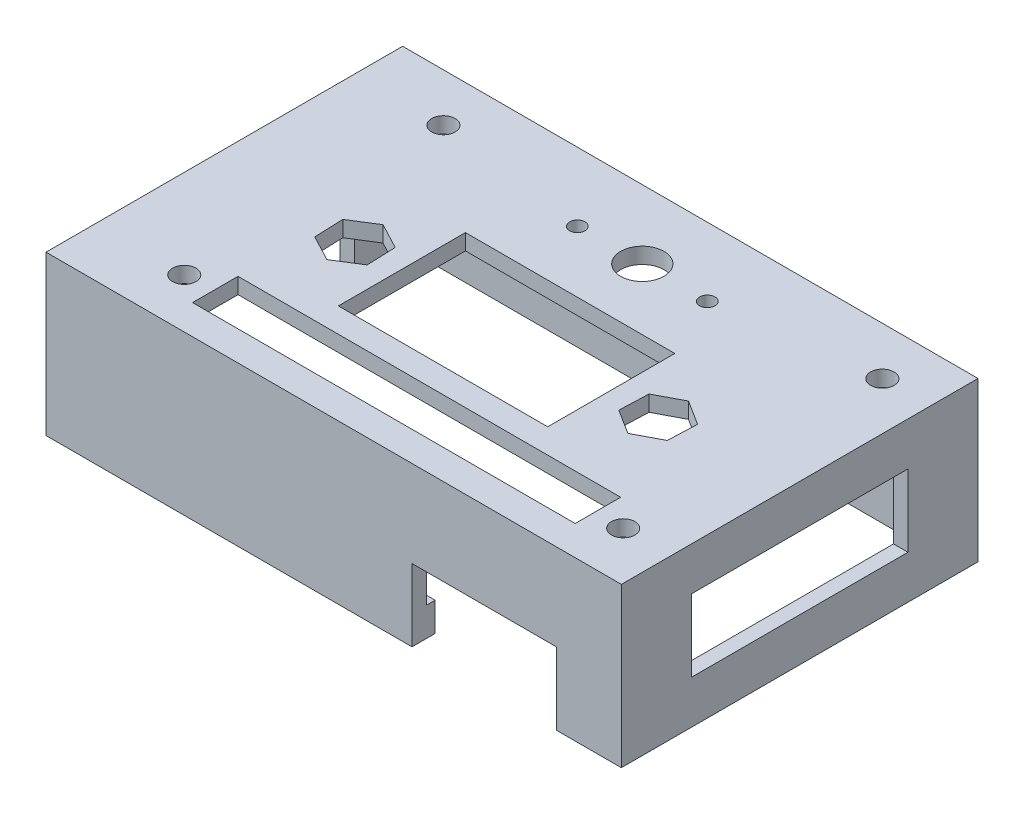
from build123d import *

# Parameters (mm, degrees)
SKETCH_1_W           = 70
SKETCH_1_H           = 45.4
EXTRUDE_1_DEPTH      = 2.2
SKETCH_2_R           = 1.62
CUT_EXTRUDE_1_DEPTH  = 12.2
SKETCH_3_W           = 29
SKETCH_3_H           = 17.6
CUT_EXTRUDE_2_DEPTH  = 12.2
SKETCH_5_R           = 1.07
SKETCH_5_R_2         = 3
CUT_EXTRUDE_4_DEPTH  = 12.2
SKETCH_6_W           = 53
SKETCH_6_H           = 6.3
CUT_EXTRUDE_5_DEPTH  = 12.2
SKETCH_7_W           = 75.7
SKETCH_7_H           = 2
EXTRUDE_3_DEPTH      = 22
SKETCH_8_W           = 2
SKETCH_8_H           = 49.4
EXTRUDE_4_DEPTH      = 22
SKETCH_9_W           = 75.7
SKETCH_9_H           = 2
EXTRUDE_5_DEPTH      = 22
SKETCH_10_W          = 5.7
SKETCH_10_H          = 45.4
EXTRUDE_6_DEPTH      = 2.2
SKETCH_11_W          = 2
SKETCH_11_H          = 49.4
EXTRUDE_7_DEPTH      = 22
SKETCH_12_W          = 20
SKETCH_12_H          = 10
CUT_EXTRUDE_6_DEPTH  = 22
SKETCH_13_W          = 32
SKETCH_13_H          = 6
CUT_EXTRUDE_7_DEPTH  = 22
SKETCH_14_W          = 30
SKETCH_14_H          = 10
CUT_EXTRUDE_8_DEPTH  = 22
SKETCH_16_W          = 70
SKETCH_16_H          = 10
CUT_EXTRUDE_9_DEPTH  = 22
SKETCH_17_W          = 48.7
SKETCH_17_H          = 4
EXTRUDE_8_DEPTH      = 1.2
SKETCH_18_W          = 7
SKETCH_18_H          = 4
EXTRUDE_9_DEPTH      = 1.2
CUT_EXTRUDE_10_DEPTH = 11.2


with BuildPart() as part:
    # 草图1 → 凸台-拉伸1 (new body)
    with BuildSketch(Plane(origin=(0, 0, 0), x_dir=(1, 0, 0), z_dir=(0, 1, 0))):
        Rectangle(SKETCH_1_W, SKETCH_1_H)
    extrude(amount=EXTRUDE_1_DEPTH)

    # 草图2 → 切除-拉伸1 (cut)
    with BuildSketch(Plane(origin=(0, 2.2, 0), x_dir=(1, 0, 0), z_dir=(0, 1, 0))):
        with Locations(Location((-30.4, 18.05, 0), (0, 0, 270))):
            Circle(SKETCH_2_R)
        with Locations(Location((-30.4, -17.85, 0), (0, 0, 270))):
            Circle(SKETCH_2_R)
        with Locations(Location((30.4, -17.85, 0), (0, 0, 270))):
            Circle(SKETCH_2_R)
        with Locations(Location((30.4, 18.05, 0), (0, 0, 270))):
            Circle(SKETCH_2_R)
    extrude(amount=-CUT_EXTRUDE_1_DEPTH, mode=Mode.SUBTRACT)

    # 草图3 → 切除-拉伸2 (cut)
    with BuildSketch(Plane(origin=(0, 2.2, 0), x_dir=(1, 0, 0), z_dir=(0, 1, 0))):
        with Locations((-1.5, -2.1)):
            Rectangle(SKETCH_3_W, SKETCH_3_H)
    extrude(amount=-CUT_EXTRUDE_2_DEPTH, mode=Mode.SUBTRACT)

    # 草图5 → 切除-拉伸4 (cut)
    with BuildSketch(Plane(origin=(0, 2.2, 0), x_dir=(1, 0, 0), z_dir=(0, 1, 0))):
        with Locations(Location((9, 15.2, 0), (0, 0, 270))):
            Circle(SKETCH_5_R)
        with Locations(Location((-9, 15.2, 0), (0, 0, 270))):
            Circle(SKETCH_5_R)
        with Locations(Location((0, 15.2, 0), (0, 0, 270))):
            Circle(SKETCH_5_R_2)
    extrude(amount=-CUT_EXTRUDE_4_DEPTH, mode=Mode.SUBTRACT)

    # 草图6 → 切除-拉伸5 (cut)
    with BuildSketch(Plane(origin=(0, 2.2, 0), x_dir=(1, 0, 0), z_dir=(0, 1, 0))):
        with Locations((0, -17.45)):
            Rectangle(SKETCH_6_W, SKETCH_6_H)
    extrude(amount=-CUT_EXTRUDE_5_DEPTH, mode=Mode.SUBTRACT)

    # 草图7 → 凸台-拉伸3 (add)
    with BuildSketch(Plane(origin=(0, 2.2, 0), x_dir=(1, 0, 0), z_dir=(0, 1, 0))):
        with Locations((-2.85, 23.7)):
            Rectangle(SKETCH_7_W, SKETCH_7_H)
    extrude(amount=-EXTRUDE_3_DEPTH)

    # 草图8 → 凸台-拉伸4 (add)
    with BuildSketch(Plane(origin=(0, 2.2, 0), x_dir=(1, 0, 0), z_dir=(0, 1, 0))):
        with Locations((36, 0)):
            Rectangle(SKETCH_8_W, SKETCH_8_H)
    extrude(amount=-EXTRUDE_4_DEPTH)

    # 草图9 → 凸台-拉伸5 (add)
    with BuildSketch(Plane(origin=(0, 2.2, 0), x_dir=(1, 0, 0), z_dir=(0, 1, 0))):
        with Locations((-2.85, -23.7)):
            Rectangle(SKETCH_9_W, SKETCH_9_H)
    extrude(amount=-EXTRUDE_5_DEPTH)

    # 草图10 → 凸台-拉伸6 (add)
    with BuildSketch(Plane(origin=(0, 2.2, 0), x_dir=(1, 0, 0), z_dir=(0, 1, 0))):
        with Locations((-37.85, 0)):
            Rectangle(SKETCH_10_W, SKETCH_10_H)
    extrude(amount=-EXTRUDE_6_DEPTH)

    # 草图11 → 凸台-拉伸7 (add)
    with BuildSketch(Plane(origin=(0, 2.2, 0), x_dir=(1, 0, 0), z_dir=(0, 1, 0))):
        with Locations((-41.7, 0)):
            Rectangle(SKETCH_11_W, SKETCH_11_H)
    extrude(amount=-EXTRUDE_7_DEPTH)

    # 草图12 → 切除-拉伸6 (cut)
    with BuildSketch(Plane.XY.offset(24.7)):
        with Locations((18, -14.8)):
            Rectangle(SKETCH_12_W, SKETCH_12_H)
    extrude(amount=-CUT_EXTRUDE_6_DEPTH, mode=Mode.SUBTRACT)

    # 草图13 → 切除-拉伸7 (cut)
    with BuildSketch(Plane.ZY.offset(42.7)):
        with Locations((0, -16.8)):
            Rectangle(SKETCH_13_W, SKETCH_13_H)
    extrude(amount=-CUT_EXTRUDE_7_DEPTH, mode=Mode.SUBTRACT)

    # 草图14 → 切除-拉伸8 (cut)
    with BuildSketch(Plane(origin=(37, 0, 0), x_dir=(0, 0, -1), z_dir=(1, 0, 0))):
        with Locations((0, -8.8)):
            Rectangle(SKETCH_14_W, SKETCH_14_H)
    extrude(amount=-CUT_EXTRUDE_8_DEPTH, mode=Mode.SUBTRACT)

    # 草图16 → 切除-拉伸9 (cut)
    with BuildSketch(Plane(origin=(0, 0, -24.7), x_dir=(-1, 0, 0), z_dir=(0, 0, -1))):
        with Locations((2.85, -5.8)):
            Rectangle(SKETCH_16_W, SKETCH_16_H)
    extrude(amount=-CUT_EXTRUDE_9_DEPTH, mode=Mode.SUBTRACT)

    # 草图17 → 凸台-拉伸8 (add)
    with BuildSketch(Plane(origin=(0, 0, 22.7), x_dir=(-1, 0, 0), z_dir=(0, 0, -1))):
        with Locations((16.35, -17.8)):
            Rectangle(SKETCH_17_W, SKETCH_17_H)
    extrude(amount=EXTRUDE_8_DEPTH)

    # 草图18 → 凸台-拉伸9 (add)
    with BuildSketch(Plane(origin=(0, 0, 22.7), x_dir=(-1, 0, 0), z_dir=(0, 0, -1))):
        with Locations((-31.5, -17.8)):
            Rectangle(SKETCH_18_W, SKETCH_18_H)
    extrude(amount=EXTRUDE_9_DEPTH)

    # 草图19 → 切除-拉伸10 (cut)
    with BuildSketch(Plane(origin=(0, 2.2, 0), x_dir=(1, 0, 0), z_dir=(0, 1, 0))):
        Polygon((22.919485098, -4.254171533), (19.344175277, -6.13844673), (15.924690179, -3.984275197), (16.080514902, 0.054171533), (19.655824723, 1.93844673), (23.075309821, -0.215724803), align=None)
        Polygon((-19.080514902, 0.054171533), (-22.655824723, 1.93844673), (-26.075309821, -0.215724803), (-25.919485098, -4.254171533), (-22.344175277, -6.13844673), (-18.924690179, -3.984275197), align=None)
    extrude(amount=-CUT_EXTRUDE_10_DEPTH, mode=Mode.SUBTRACT)


solid = part.part
